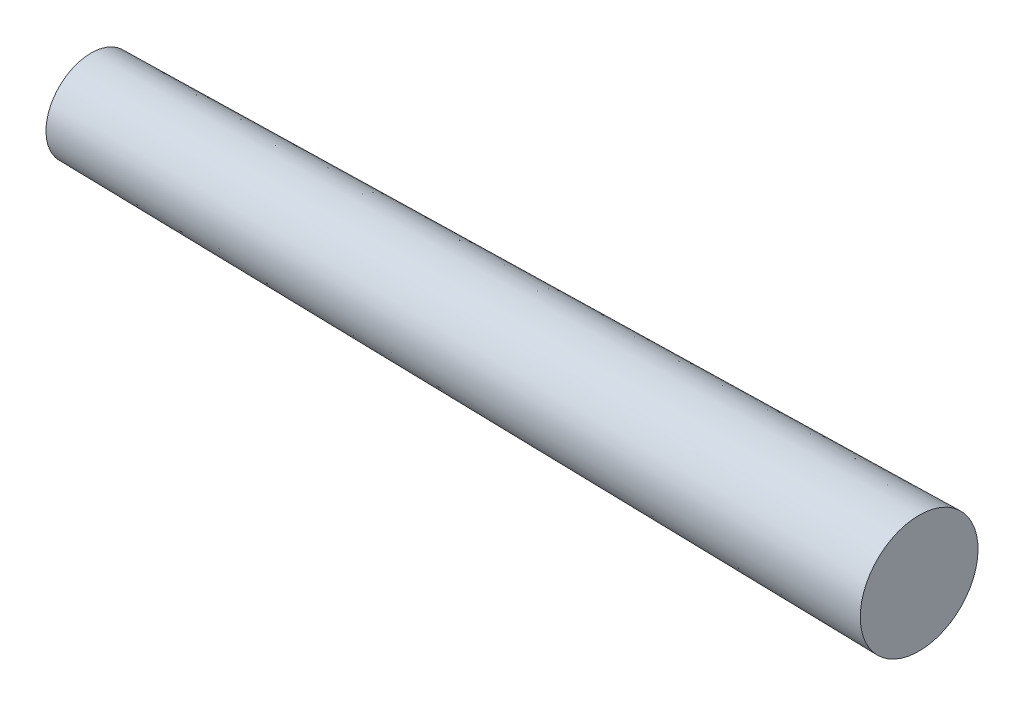
from build123d import *

# Parameters (mm, degrees)
SKIZZE4_R                       = 4.17503968
SCHNITT_LINEAR_AUSTRAGEN1_DEPTH = 5
SKIZZE7_R                       = 4.374978423
SCHNITT_LINEAR_AUSTRAGEN3_DEPTH = 5
SKIZZE8_R                       = 3.54345764
SCHNITT_LINEAR_AUSTRAGEN4_DEPTH = 5


with BuildPart() as part:
    # Skizze1 → Rotation1 (revolve)
    with BuildSketch(Plane.XY):
        Polygon((-10.538234355, 0), (-10.538234355, 2.5), (79.461765645, 4), (79.461765645, 0), align=None)
    revolve(axis=Axis((79.461765645, 0, 0), (-1, 0, 0)))

    # Skizze4 → Schnitt-Linear austragen1 (cut)
    with BuildSketch(Plane(origin=(79.461765645, 0, 0), x_dir=(0, 0, -1), z_dir=(1, 0, 0))):
        Circle(SKIZZE4_R)
    extrude(amount=-SCHNITT_LINEAR_AUSTRAGEN1_DEPTH, mode=Mode.SUBTRACT)

    # Skizze7 → Schnitt-Linear austragen3 (cut)
    with BuildSketch(Plane(origin=(74.461765645, 0, 0), x_dir=(0, 0, -1), z_dir=(1, 0, 0))):
        Circle(SKIZZE7_R)
    extrude(amount=-SCHNITT_LINEAR_AUSTRAGEN3_DEPTH, mode=Mode.SUBTRACT)

    # Skizze8 → Schnitt-Linear austragen4 (cut)
    with BuildSketch(Plane.ZY.offset(10.538234355)):
        Circle(SKIZZE8_R)
    extrude(amount=-SCHNITT_LINEAR_AUSTRAGEN4_DEPTH, mode=Mode.SUBTRACT)

    # Skizze9 → Rotation2 (revolve)
    with BuildSketch(Plane.XY):
        Polygon((69.461765645, 3.833333333), (69.461765645, 5.333333333), (-5.538234355, 4.083333333), (-5.538234355, 2.583333333), align=None)
    revolve(axis=Axis((69.461765645, 0, 0), (-1, 0, 0)))


solid = part.part
